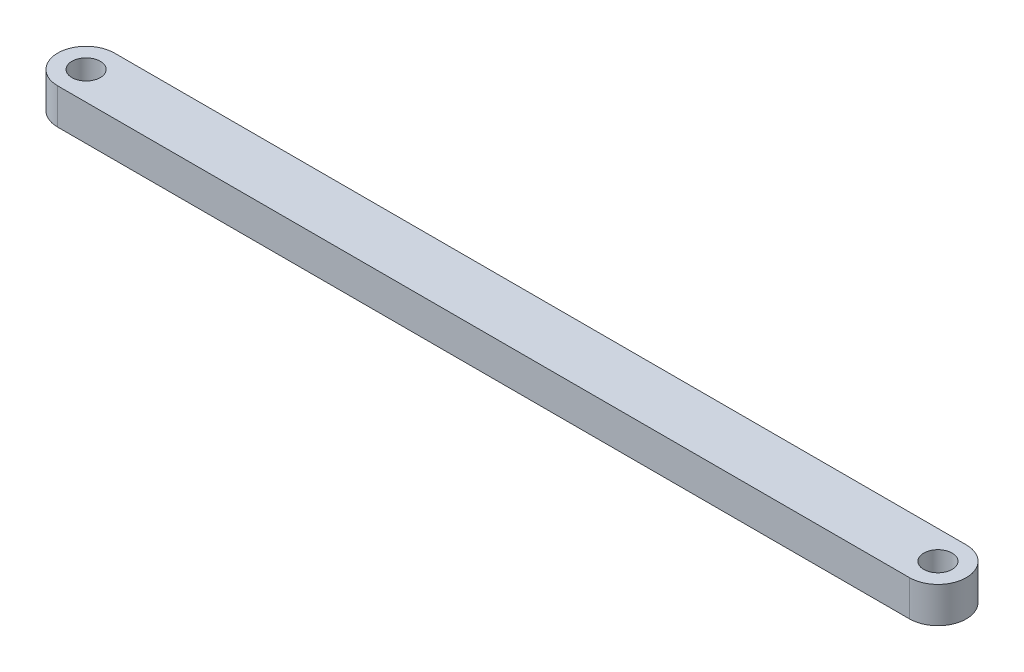
from build123d import *

# Parameters (mm, degrees)
SKETCH1_R           = 1.27
BOSS_EXTRUDE1_DEPTH = 3.2004


with BuildPart() as part:
    # Sketch1 → Boss-Extrude1 (new body)
    with BuildSketch(Plane(origin=(0, 0, 0), x_dir=(1, 0, 0), z_dir=(0, 1, 0))):
        with BuildLine():
            Line((-95.249999991, 2.54), (-19.049999991, 2.54))
            ThreePointArc((-19.049999991, 2.54), (-16.509999991, 5.08), (-19.049999991, 7.62))
            Line((-19.049999991, 7.62), (-95.249999991, 7.62))
            ThreePointArc((-95.249999991, 7.62), (-97.789999991, 5.08), (-95.249999991, 2.54))
        make_face()
        with Locations(Location((-19.049999991, 5.08, 0), (0, 0, 270))):
            Circle(SKETCH1_R, mode=Mode.SUBTRACT)
        with Locations(Location((-95.249999991, 5.08, 0), (0, 0, 270))):
            Circle(SKETCH1_R, mode=Mode.SUBTRACT)
    extrude(amount=BOSS_EXTRUDE1_DEPTH)


solid = part.part
